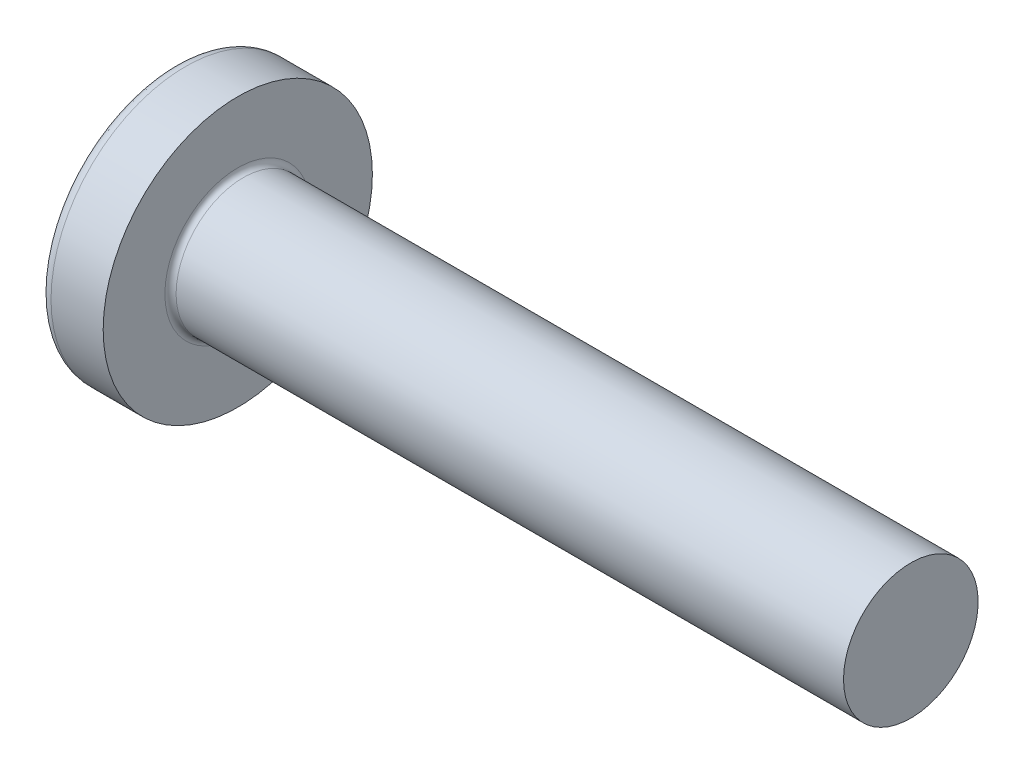
from build123d import *

# Parameters (mm, degrees)
FILLET1_R    = 0.25
RECPAT_COUNT = 2
RECPAT_ANGLE = 90


with BuildPart() as part:
    # BodySke → Base-Revolve (revolve)
    with BuildSketch(Plane.XY, mode=Mode.PRIVATE) as base_revolve_sk:
        with BuildLine():
            Line((4.6, 3), (4.6, 6))
            Line((4.6, 6), (2.274716834, 6))
            ThreePointArc((2.274716834, 6), (2.026424569, 5.939532013), (1.833738725, 5.77167019))
            ThreePointArc((1.833738725, 5.77167019), (0.469454036, 3.027985077), (0, 0))
            Line((0, 0), (34.6, 0))
            Line((34.6, 0), (34.6, 3))
            Line((34.6, 3), (4.6, 3))
        make_face()
    revolve(base_revolve_sk.sketch.rotate(Axis((2.274716834, 0, 0), (1, 0, 0)), 90), axis=Axis((2.274716834, 0, 0), (1, 0, 0)))

    # Fillet1
    fillet1_edges = [part.edges().sort_by_distance(p)[0] for p in [
        (4.6, 0, -3),
    ]]
    fillet(fillet1_edges, radius=FILLET1_R)

    # Sketch3 → Recess section 0
    with BuildSketch(Plane(origin=(0, 0, 0), x_dir=(0, 0, -1), z_dir=(1, 0, 0))):
        with BuildLine():
            Line((0.71, -3.35), (-0.71, -3.35))
            Line((-0.71, -3.35), (-0.71, 3.35))
            Line((-0.71, 3.35), (0.71, 3.35))
            Line((0.71, 3.35), (0.71, -3.35))
        make_face()
    # Sketch4 → Recess section 1
    with BuildSketch(Plane(origin=(3.46, 0, 0), x_dir=(0, 0, -1), z_dir=(1, 0, 0))):
        with BuildLine():
            Line((0.71, -1.624907925), (-0.71, -1.624907925))
            Line((-0.71, -1.624907925), (-0.71, 1.624907925))
            Line((-0.71, 1.624907925), (0.71, 1.624907925))
            Line((0.71, 1.624907925), (0.71, -1.624907925))
        make_face()
    recess = loft(mode=Mode.SUBTRACT)

    # RecPat: Recess ×2 about axis
    recpat_axis = Axis((0, 0, 0), (1, 0, 0))
    for i in range(1, RECPAT_COUNT):
        add(recess.rotate(recpat_axis, i * RECPAT_ANGLE / (RECPAT_COUNT - 1)), mode=Mode.SUBTRACT)

    # RecCorSke → RecessCore (revolve, cut)
    with BuildSketch(Plane.XY, mode=Mode.PRIVATE) as recesscore_sk:
        Polygon((0, 0), (0, 1.522446769), (3.46, 1.2805), (3.876059671, 0), align=None)
    revolve(recesscore_sk.sketch.rotate(Axis((-3.175, 0, 0), (1, 0, 0)), 12.930791927), axis=Axis((-3.175, 0, 0), (1, 0, 0)), mode=Mode.SUBTRACT)


solid = part.part
